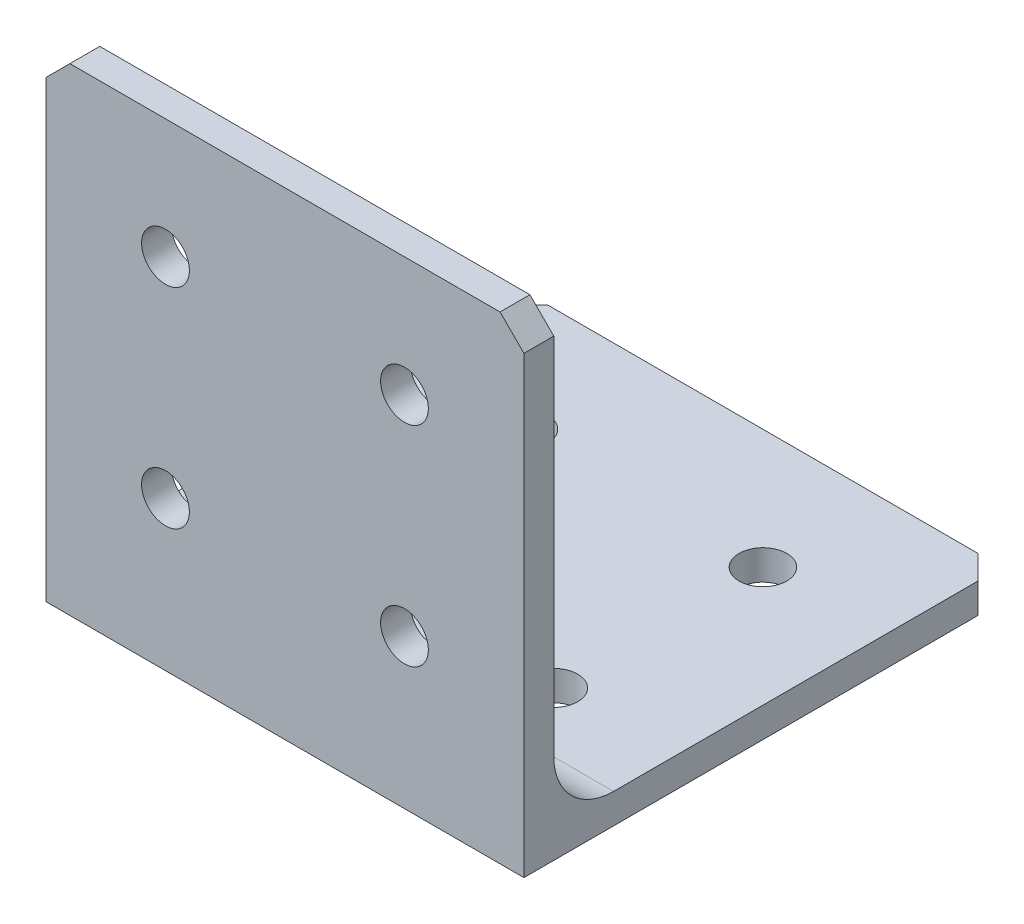
from build123d import *

# Parameters (mm, degrees)
BOSS_EXTRUDE1_DEPTH = 50.8
SKETCH2_R           = 2.54
CUT_EXTRUDE1_DEPTH  = 88.988181024
SKETCH3_R           = 2.54
CUT_EXTRUDE2_DEPTH  = 88.988181024
FILLET1_R           = 6.35
CHAMFER1_SIZE       = 2.54


with BuildPart() as part:
    # Sketch1 → Boss-Extrude1 (new body)
    with BuildSketch(Plane(origin=(0, 0, 0), x_dir=(0, 0, -1), z_dir=(1, 0, 0))):
        Polygon((0, 0), (0, 50.8), (3.175, 50.8), (3.175, 3.175), (50.8, 3.175), (50.8, 0), align=None)
    extrude(amount=BOSS_EXTRUDE1_DEPTH)

    # Sketch2 → Cut-Extrude1 (cut, through all)
    with BuildSketch(Plane.XY):
        with Locations((12.7, 38.1)):
            Circle(SKETCH2_R)
        with Locations((12.7, 15.875)):
            Circle(SKETCH2_R)
        with Locations((38.1, 38.1)):
            Circle(SKETCH2_R)
        with Locations((38.1, 15.875)):
            Circle(SKETCH2_R)
    extrude(amount=-CUT_EXTRUDE1_DEPTH, mode=Mode.SUBTRACT)

    # Sketch3 → Cut-Extrude2 (cut, through all)
    with BuildSketch(Plane.XZ):
        with Locations(Location((38.1, -38.1, 0), (0, 0, 270))):
            Circle(SKETCH3_R)
        with Locations(Location((38.1, -15.875, 0), (0, 0, 270))):
            Circle(SKETCH3_R)
        with Locations(Location((12.7, -38.1, 0), (0, 0, 270))):
            Circle(SKETCH3_R)
        with Locations(Location((12.7, -15.875, 0), (0, 0, 270))):
            Circle(SKETCH3_R)
    extrude(amount=-CUT_EXTRUDE2_DEPTH, mode=Mode.SUBTRACT)

    # Fillet1
    fillet1_edges = [part.edges().sort_by_distance(p)[0] for p in [
        (25.4, 3.175, -3.175),
    ]]
    fillet(fillet1_edges, radius=FILLET1_R)

    # Chamfer1
    chamfer1_edges = [part.edges().sort_by_distance(p)[0] for p in [
        (50.8, 50.8, -1.5875),
        (0, 50.8, -1.5875),
        (0, 1.5875, -50.8),
        (50.8, 1.5875, -50.8),
    ]]
    chamfer(chamfer1_edges, length=CHAMFER1_SIZE)


solid = part.part
